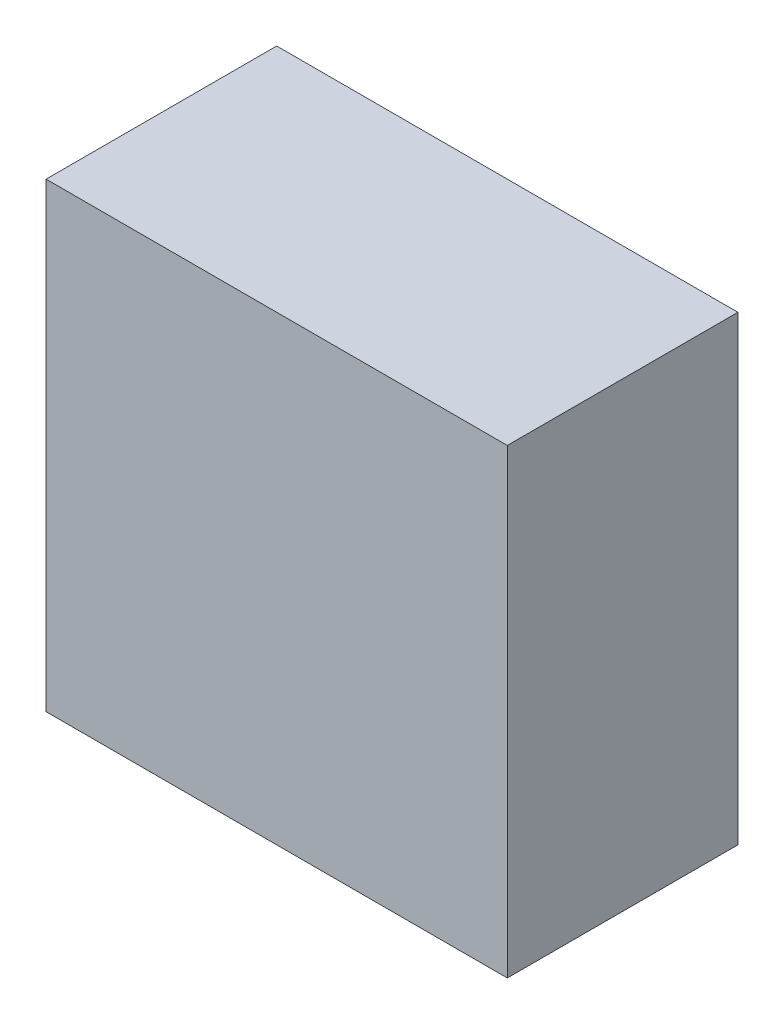
from build123d import *

# Parameters (mm, degrees)
SKETCH1_W           = 3048
SKETCH1_H           = 3048
BOSS_EXTRUDE1_DEPTH = 1524


with BuildPart() as part:
    # Sketch1 → Boss-Extrude1 (new body)
    with BuildSketch(Plane.XY):
        with Locations((1524, 1524)):
            Rectangle(SKETCH1_W, SKETCH1_H)
    extrude(amount=BOSS_EXTRUDE1_DEPTH)


solid = part.part
